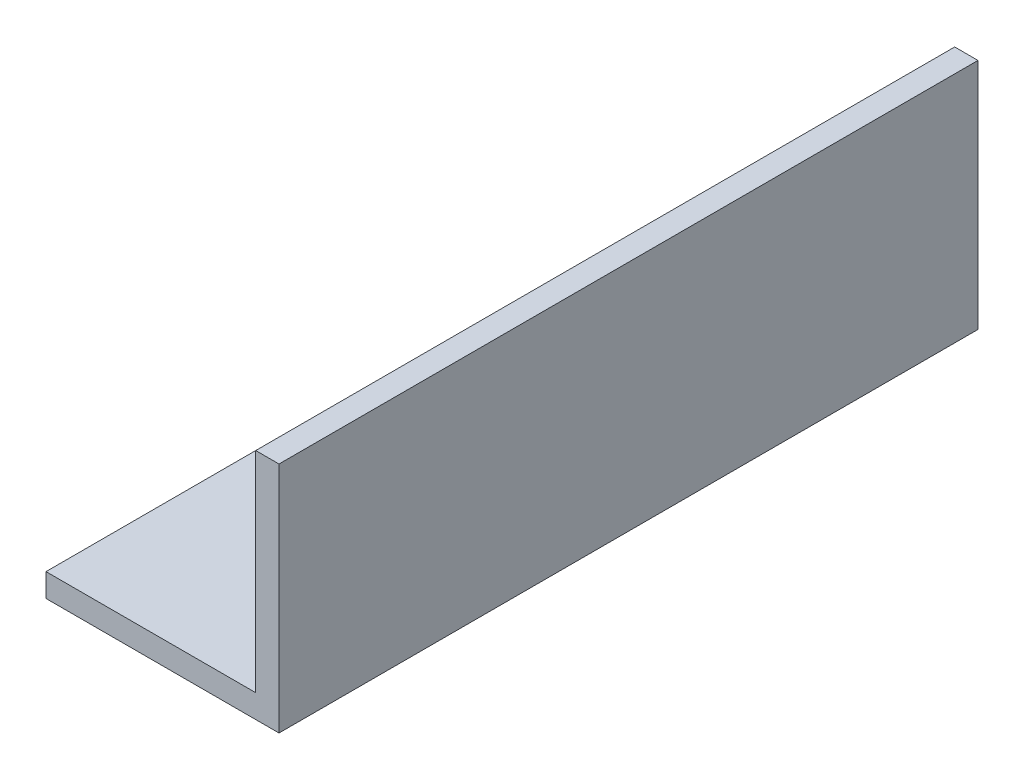
from build123d import *

# Parameters (mm, degrees)
EXTRUDE_1_DEPTH       = 30
HOLE_WIZARD_3_0_3_1_D = 3


with BuildPart() as part:
    # Эскиз1 → Бобышка-Вытянуть1 (new body)
    with BuildSketch(Plane.XY):
        Polygon((4, 0.5), (-5, 0.5), (-5, -0.5), (5, -0.5), (5, 0.5), (5, 9.5), (4, 9.5), align=None)
    extrude(amount=EXTRUDE_1_DEPTH)

    # Диаметр отверстия Ø3.0 (3)1 (through all)
    with Locations(Plane(origin=(0, 0.5, 0), x_dir=(1, 0, 0), z_dir=(0, 1, 0))):
        with Locations((-0.5, -10), (-0.5, -20)):
            Hole(HOLE_WIZARD_3_0_3_1_D / 2)


solid = part.part
